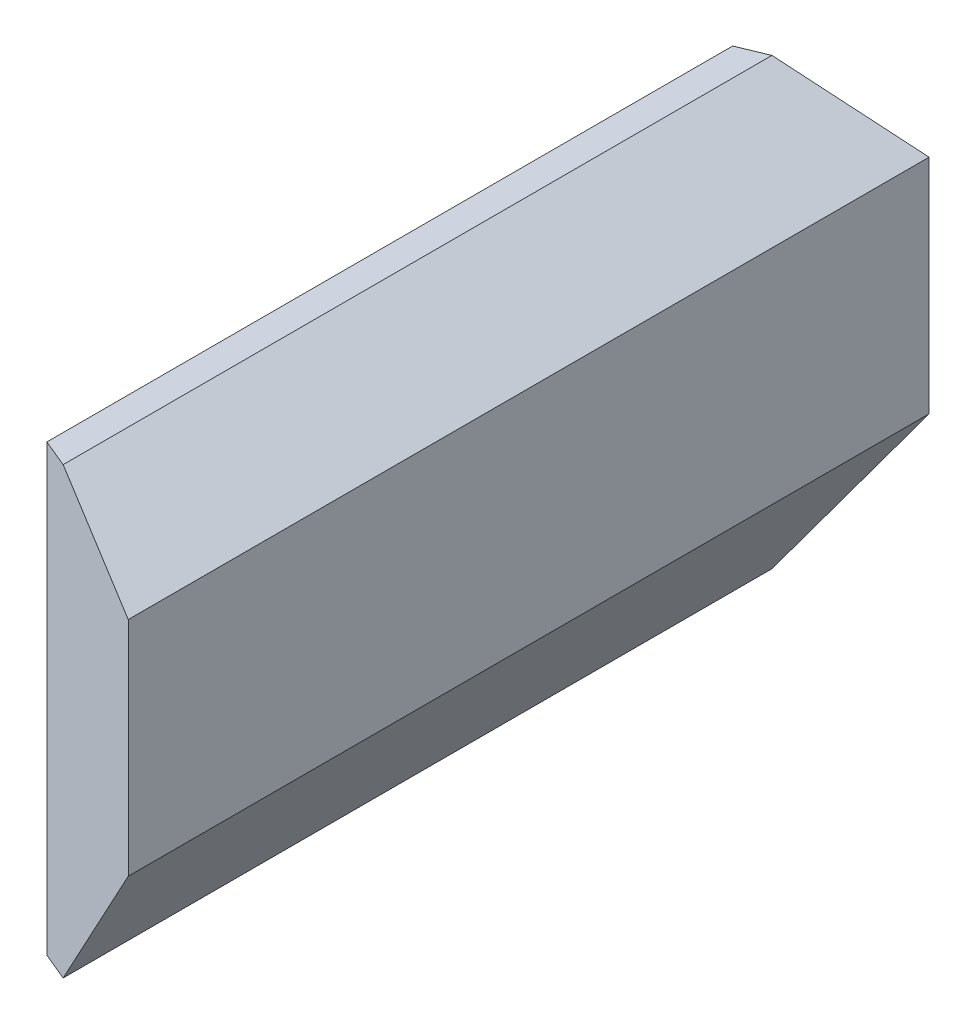
from build123d import *

# Parameters (mm, degrees)
EXTRUDE_1_DEPTH     = 150
CUT_EXTRUDE_1_REACH = 173.828
CUT_EXTRUDE_2_DEPTH = 53
CUT_EXTRUDE_3_DEPTH = 53


with BuildPart() as part:
    # 草图1 → 拉伸1 (new body)
    with BuildSketch(Plane.XY):
        Polygon((0, 40), (0, 50), (5, 50), (25, 40), (25, 0), (5, -30), (0, -30), (0, 0), align=None)
    extrude(amount=EXTRUDE_1_DEPTH)

    # 草图2 → 切除-拉伸1 (cut, up to next)
    with BuildSketch(Plane(origin=(0, 50, 0), x_dir=(-1, 0, 0), z_dir=(0, 1, 0)), mode=Mode.PRIVATE) as cut_extrude_1_sk1:
        Polygon((0, 13.3), (-66.261919137, -14.146585575), (0, -14.146585575), align=None)
    cut_extrude_1_tool1 = extrude(cut_extrude_1_sk1.sketch, amount=-CUT_EXTRUDE_1_REACH, mode=Mode.PRIVATE) & part.part
    # 草图2 → 切除-拉伸1 (cut, up to next)
    with BuildSketch(Plane(origin=(0, 50, 0), x_dir=(-1, 0, 0), z_dir=(0, 1, 0)), mode=Mode.PRIVATE) as cut_extrude_1_sk2:
        Polygon((0, 136.7), (-66.261919137, 164.146585575), (0, 164.146585575), align=None)
    cut_extrude_1_tool2 = extrude(cut_extrude_1_sk2.sketch, amount=-CUT_EXTRUDE_1_REACH, mode=Mode.PRIVATE) & part.part
    add(cut_extrude_1_tool1.solids().sort_by_distance((22.087306, 50, -4.997724))[0], mode=Mode.SUBTRACT)
    add(cut_extrude_1_tool2.solids().sort_by_distance((22.087306, 50, 154.997724))[0], mode=Mode.SUBTRACT)

    # 草图4 → 切除-拉伸2 (cut)
    with BuildSketch(Plane(origin=(0, 0, 18.3), x_dir=(-1, 0, 0), z_dir=(0, 0, -1))):
        Polygon((0, 45), (-6.05572809, 45), (-21, 37.527864045), (-21, 1.211102551), (-3.525931633, -25), (0, -25), align=None)
    extrude(amount=-CUT_EXTRUDE_2_DEPTH, mode=Mode.SUBTRACT)

    # 草图5 → 切除-拉伸3 (cut)
    with BuildSketch(Plane(origin=(0, 0, 131.7), x_dir=(-1, 0, 0), z_dir=(0, 0, -1))):
        Polygon((0, 45), (-6.05572809, 45), (-21, 37.527864045), (-21, 1.211102551), (-3.525931633, -25), (0, -25), align=None)
    extrude(amount=CUT_EXTRUDE_3_DEPTH, mode=Mode.SUBTRACT)


solid = part.part
